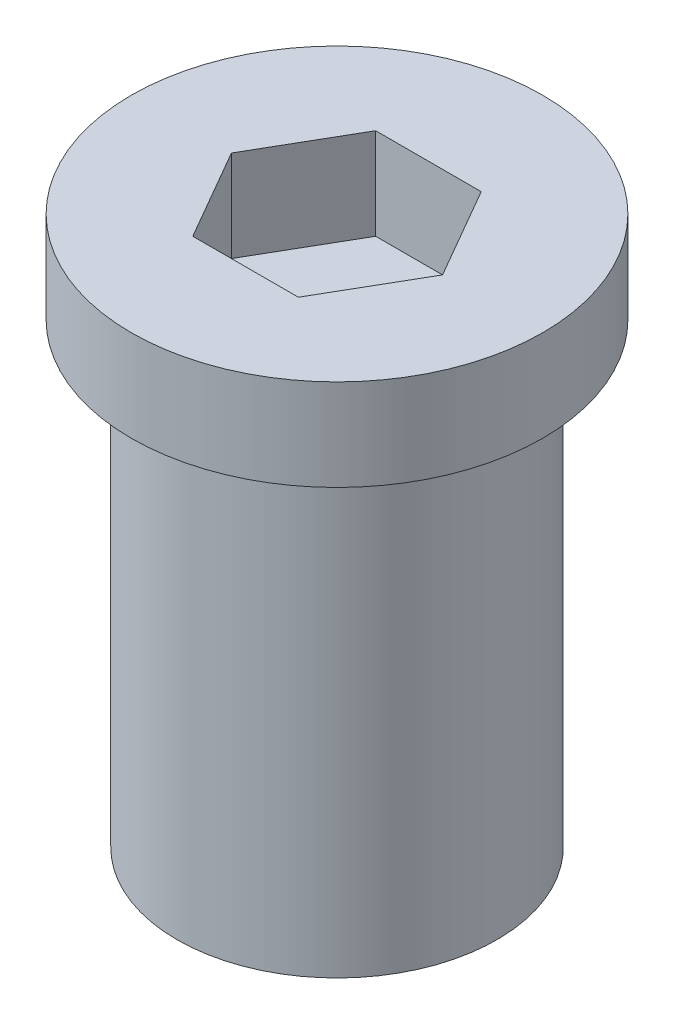
from build123d import *

# Parameters (mm, degrees)
SKETCH1_R           = 1.75
BOSS_EXTRUDE1_DEPTH = 2.5
SKETCH2_R           = 2.25
BOSS_EXTRUDE2_DEPTH = 1
CUT_EXTRUDE1_DEPTH  = 1


with BuildPart() as part:
    # Sketch1 → Boss-Extrude1 (new, symmetric)
    with BuildSketch(Plane(origin=(0, 0, 0), x_dir=(1, 0, 0), z_dir=(0, 1, 0))):
        with Locations(Location((0, 0, 0), (0, 0, 270))):
            Circle(SKETCH1_R)
    extrude(amount=BOSS_EXTRUDE1_DEPTH, both=True)

    # Sketch2 → Boss-Extrude2 (add)
    with BuildSketch(Plane(origin=(0, 2.5, 0), x_dir=(1, 0, 0), z_dir=(0, 1, 0))):
        with Locations(Location((0, 0, 0), (0, 0, 270))):
            Circle(SKETCH2_R)
    extrude(amount=BOSS_EXTRUDE2_DEPTH)

    # Sketch3 → Cut-Extrude1 (cut)
    with BuildSketch(Plane(origin=(0, 3.5, 0), x_dir=(1, 0, 0), z_dir=(0, 1, 0))):
        Polygon((1.154700545, 0), (0.577350266, 0.999999994), (-0.577350273, 1.000000006), (-1.154700532, 0), (-0.577350273, -1.000000006), (0.577350266, -0.999999994), align=None)
    extrude(amount=-CUT_EXTRUDE1_DEPTH, mode=Mode.SUBTRACT)


solid = part.part
